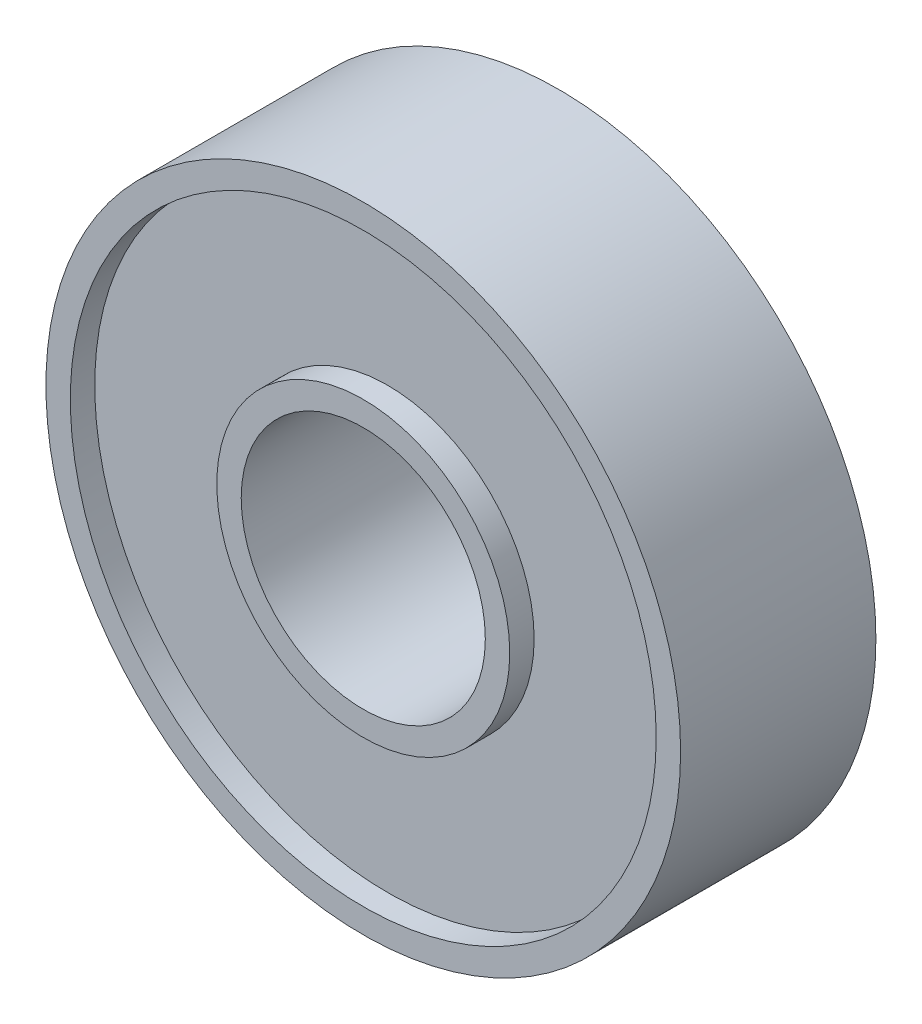
from build123d import *

# Parameters (mm, degrees)
SKETCH_1_R          = 6.5
SKETCH_1_R_2        = 2.5
EXTRUDE_1_DEPTH     = 4
SKETCH_2_R          = 6
SKETCH_2_R_2        = 3
CUT_EXTRUDE_1_DEPTH = 0.5
CUT_EXTRUDE_START   = -0.5
SKETCH_3_R          = 6
SKETCH_3_R_2        = 3
CUT_EXTRUDE_2_DEPTH = 0.5


with BuildPart() as part:
    # 草图1 → 凸台-拉伸1 (new body)
    with BuildSketch(Plane.XY):
        Circle(SKETCH_1_R)
        Circle(SKETCH_1_R_2, mode=Mode.SUBTRACT)
    extrude(amount=EXTRUDE_1_DEPTH)

    # 草图2 → 切除-拉伸1 (cut)
    with BuildSketch(Plane.XY.offset(4)):
        Circle(SKETCH_2_R)
        Circle(SKETCH_2_R_2, mode=Mode.SUBTRACT)
    extrude(amount=-CUT_EXTRUDE_1_DEPTH, mode=Mode.SUBTRACT)

    # 草图3 → 切除-拉伸2 (cut)
    with BuildSketch(Plane(origin=(0, 0, 0), x_dir=(-1, 0, 0), z_dir=(0, 0, -1)).offset(CUT_EXTRUDE_START)):
        with Locations(Location((0, 0, 0), (0, 0, 180))):
            Circle(SKETCH_3_R)
        with Locations(Location((0, 0, 0), (0, 0, 180))):
            Circle(SKETCH_3_R_2, mode=Mode.SUBTRACT)
    extrude(amount=CUT_EXTRUDE_2_DEPTH, mode=Mode.SUBTRACT)


solid = part.part
